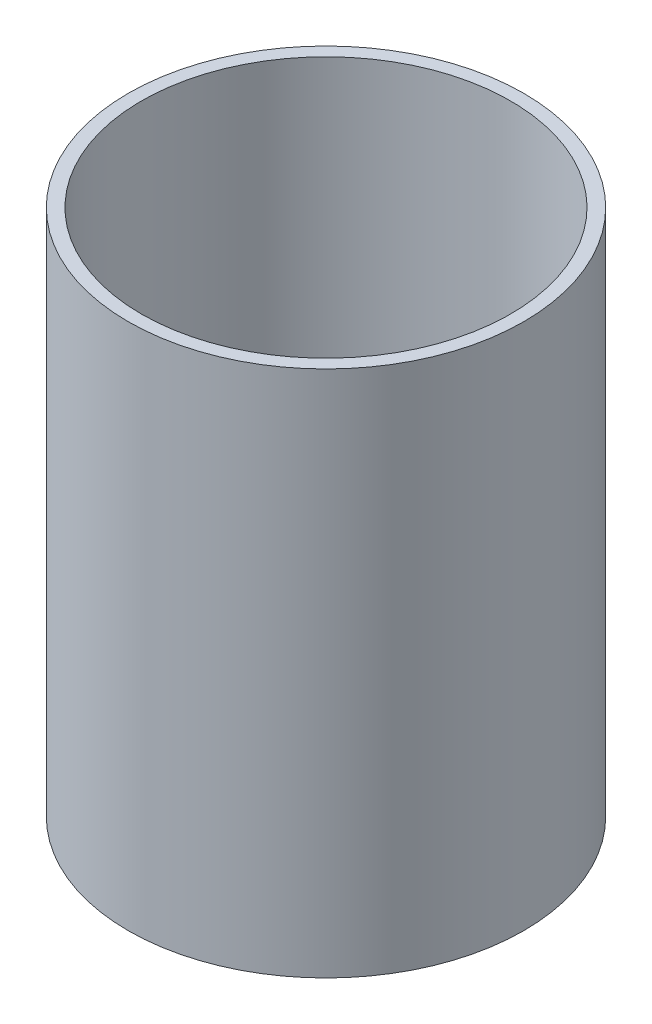
from build123d import *

# Parameters (mm, degrees)
ESBO_O1_R   = 15
ESBO_O1_R_2 = 14


with BuildPart() as part:
    # Varredura1: sweep along a path in Esboço2
    with BuildLine(Plane.XY) as varredura1_path:
        Line((0, 0), (0, -40))
    # Esboço1 → Varredura1 (sweep)
    with BuildSketch(Plane(origin=(0, 0, 0), x_dir=(1, 0, 0), z_dir=(0, 1, 0))):
        Circle(ESBO_O1_R)
        Circle(ESBO_O1_R_2, mode=Mode.SUBTRACT)
    sweep(path=varredura1_path.line)


solid = part.part
